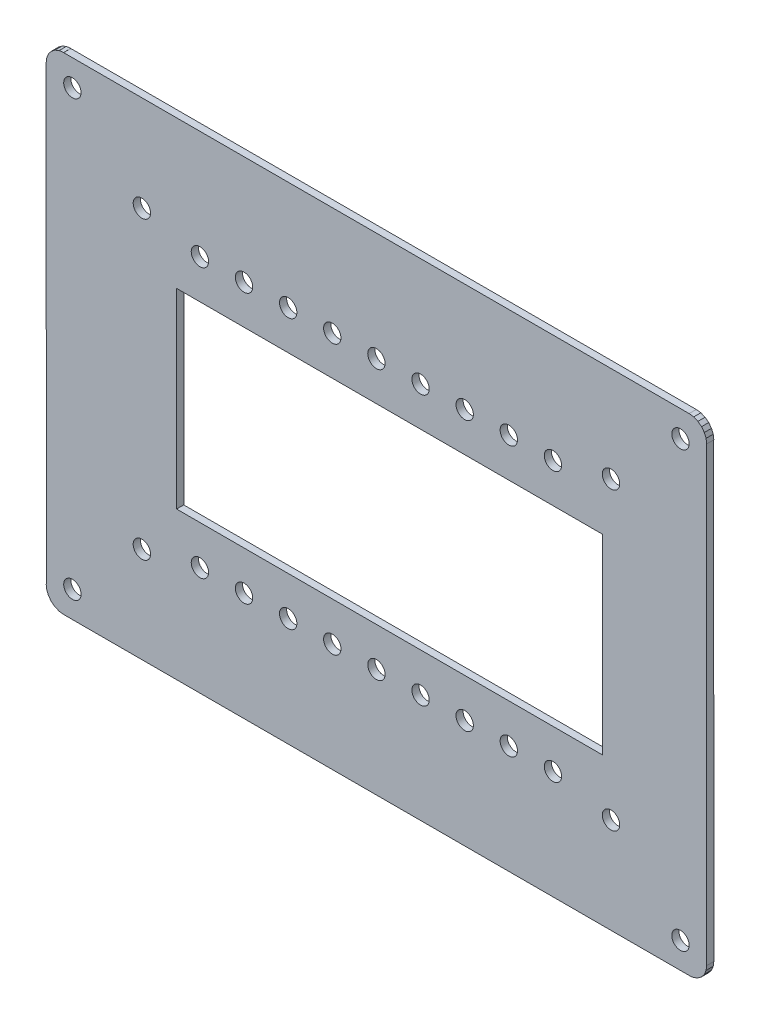
from build123d import *

# Parameters (mm, degrees)
SKETCH_1_R      = 0.499999
SKETCH_1_W      = 24.49999926
SKETCH_1_H      = 11.00000086
EXTRUDE_1_DEPTH = 0.41148


with BuildPart() as part:
    # 草图1 → 凸台-拉伸1 (new body)
    with BuildSketch(Plane.XY):
        Polygon((1.5257399, 2.2389465), (1.6265017, 1.99568562), (1.78679094, 1.78679094), (1.99568562, 1.6265017), (2.2389465, 1.5257399), (2.50000008, 1.49137116), (38.4999992, 1.49999954), (38.4999992, 1.49137116), (38.76105278, 1.5257399), (39.00431366, 1.6265017), (39.21320834, 1.78679094), (39.37349758, 1.99568562), (39.47425938, 2.2389465), (39.50862812, 2.50000008), (39.49999974, 28.49999888), (39.50862812, 28.49999888), (39.47425938, 28.76105246), (39.37349758, 29.00431334), (39.21320834, 29.21320802), (39.00431366, 29.37349726), (38.76105278, 29.47425906), (38.4999992, 29.5086278), (2.50000008, 29.49999942), (2.50000008, 29.5086278), (2.2389465, 29.47425906), (1.99568562, 29.37349726), (1.78679094, 29.21320802), (1.6265017, 29.00431334), (1.5257399, 28.76105246), (1.49137116, 28.49999888), (1.49999954, 2.50000008), (1.49137116, 2.50000008), align=None)
        with Locations(Location((38.0000002, 28.00000242, 0), (0, 0, 180))):
            Circle(SKETCH_1_R, mode=Mode.SUBTRACT)
        with Locations(Location((34.00000058, 24.00000026, 0), (0, 0, 180))):
            Circle(SKETCH_1_R, mode=Mode.SUBTRACT)
        with Locations(Location((30.65999964, 23.24999922, 0), (0, 0, 180))):
            Circle(SKETCH_1_R, mode=Mode.SUBTRACT)
        with Locations(Location((28.11999964, 23.24999922, 0), (0, 0, 180))):
            Circle(SKETCH_1_R, mode=Mode.SUBTRACT)
        with Locations(Location((23.03999964, 23.24999922, 0), (0, 0, 180))):
            Circle(SKETCH_1_R, mode=Mode.SUBTRACT)
        with Locations(Location((20.49999964, 23.24999922, 0), (0, 0, 180))):
            Circle(SKETCH_1_R, mode=Mode.SUBTRACT)
        with Locations(Location((25.57999964, 23.24999922, 0), (0, 0, 180))):
            Circle(SKETCH_1_R, mode=Mode.SUBTRACT)
        with Locations(Location((30.65999964, 7.74999974, 0), (0, 0, 180))):
            Circle(SKETCH_1_R, mode=Mode.SUBTRACT)
        with Locations(Location((28.11999964, 7.74999974, 0), (0, 0, 180))):
            Circle(SKETCH_1_R, mode=Mode.SUBTRACT)
        with Locations(Location((38.0000002, 3.00000162, 0), (0, 0, 180))):
            Circle(SKETCH_1_R, mode=Mode.SUBTRACT)
        with Locations(Location((34.00000058, 7.00000124, 0), (0, 0, 180))):
            Circle(SKETCH_1_R, mode=Mode.SUBTRACT)
        with Locations(Location((23.03999964, 7.74999974, 0), (0, 0, 180))):
            Circle(SKETCH_1_R, mode=Mode.SUBTRACT)
        with Locations(Location((20.49999964, 7.74999974, 0), (0, 0, 180))):
            Circle(SKETCH_1_R, mode=Mode.SUBTRACT)
        with Locations(Location((25.57999964, 7.74999974, 0), (0, 0, 180))):
            Circle(SKETCH_1_R, mode=Mode.SUBTRACT)
        with Locations(Location((15.41999964, 23.24999922, 0), (0, 0, 180))):
            Circle(SKETCH_1_R, mode=Mode.SUBTRACT)
        with Locations(Location((12.87999964, 23.24999922, 0), (0, 0, 180))):
            Circle(SKETCH_1_R, mode=Mode.SUBTRACT)
        with Locations(Location((17.95999964, 23.24999922, 0), (0, 0, 180))):
            Circle(SKETCH_1_R, mode=Mode.SUBTRACT)
        with Locations(Location((7.00000124, 24.00000026, 0), (0, 0, 180))):
            Circle(SKETCH_1_R, mode=Mode.SUBTRACT)
        with Locations(Location((2.99999908, 28.00000242, 0), (0, 0, 180))):
            Circle(SKETCH_1_R, mode=Mode.SUBTRACT)
        with Locations(Location((10.33999964, 23.24999922, 0), (0, 0, 180))):
            Circle(SKETCH_1_R, mode=Mode.SUBTRACT)
        with Locations(Location((15.41999964, 7.74999974, 0), (0, 0, 180))):
            Circle(SKETCH_1_R, mode=Mode.SUBTRACT)
        with Locations(Location((12.87999964, 7.74999974, 0), (0, 0, 180))):
            Circle(SKETCH_1_R, mode=Mode.SUBTRACT)
        with Locations(Location((17.95999964, 7.74999974, 0), (0, 0, 180))):
            Circle(SKETCH_1_R, mode=Mode.SUBTRACT)
        with Locations(Location((10.33999964, 7.74999974, 0), (0, 0, 180))):
            Circle(SKETCH_1_R, mode=Mode.SUBTRACT)
        with Locations(Location((7.00000124, 7.00000124, 0), (0, 0, 180))):
            Circle(SKETCH_1_R, mode=Mode.SUBTRACT)
        with Locations(Location((2.99999908, 3.00000162, 0), (0, 0, 180))):
            Circle(SKETCH_1_R, mode=Mode.SUBTRACT)
        with Locations((21.24999941, 15.50000075)):
            Rectangle(SKETCH_1_W, SKETCH_1_H, mode=Mode.SUBTRACT)
    extrude(amount=-EXTRUDE_1_DEPTH)


solid = part.part
